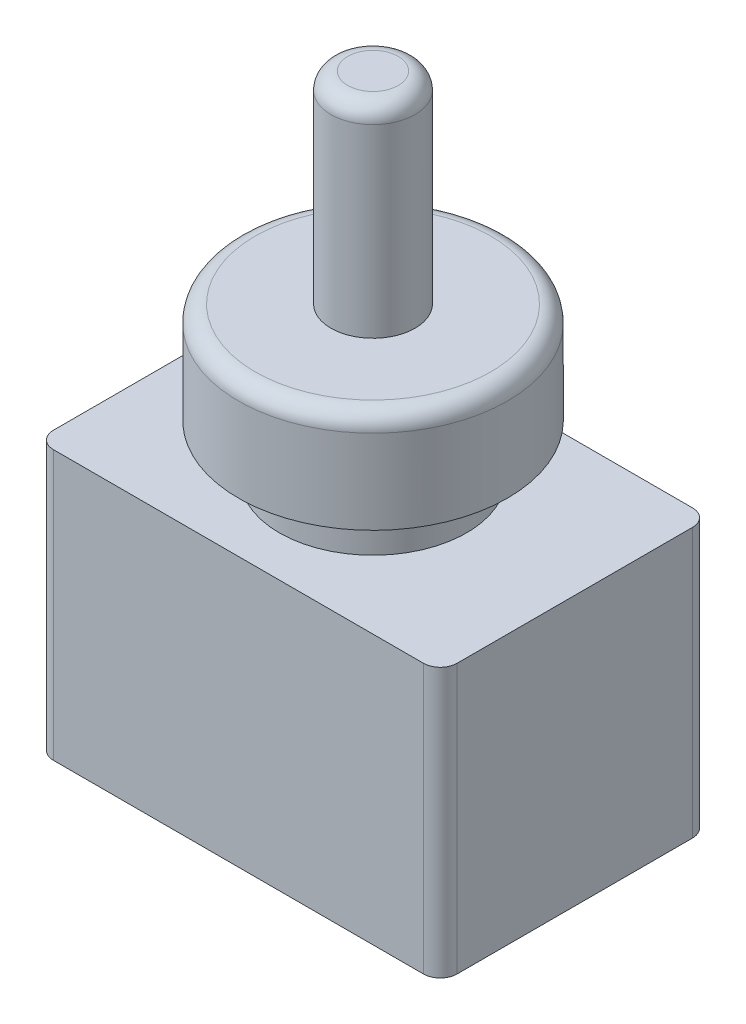
from build123d import *

# Parameters (mm, degrees)
SKETCH1_W           = 24
SKETCH1_H           = 16
BOSS_EXTRUDE1_DEPTH = 16
SKETCH2_R           = 5.571856639
BOSS_EXTRUDE2_DEPTH = 3
FILLET1_R           = 1
FILLET2_R           = 1
FILLET3_R           = 1


with BuildPart() as part:
    # Sketch1 → Boss-Extrude1 (new body)
    with BuildSketch(Plane(origin=(0, 0, 0), x_dir=(1, 0, 0), z_dir=(0, 1, 0))):
        Rectangle(SKETCH1_W, SKETCH1_H)
    extrude(amount=BOSS_EXTRUDE1_DEPTH)

    # Sketch2 → Boss-Extrude2 (add)
    with BuildSketch(Plane(origin=(0, 16, 0), x_dir=(1, 0, 0), z_dir=(0, 1, 0))):
        with Locations(Location((0, 0, 0), (0, 0, 270))):
            Circle(SKETCH2_R)
    extrude(amount=BOSS_EXTRUDE2_DEPTH)

    # Sketch4 → Revolve1 (revolve)
    with BuildSketch(Plane.XY):
        Polygon((0, 19), (8, 19), (8, 25), (2.5, 25), (2.5, 37), (0, 37), align=None)
    revolve(axis=Axis((0, 0, 0), (0, 1, 0)))

    # Fillet1
    fillet1_edges = [part.edges().sort_by_distance(p)[0] for p in [
        (-8, 25, 0),
    ]]
    fillet(fillet1_edges, radius=FILLET1_R)

    # Fillet2
    fillet2_edges = [part.edges().sort_by_distance(p)[0] for p in [
        (-2.5, 37, 0),
    ]]
    fillet(fillet2_edges, radius=FILLET2_R)

    # Fillet3
    fillet3_edges = [part.edges().sort_by_distance(p)[0] for p in [
        (12, 8, 8),
        (-12, 8, 8),
        (-12, 8, -8),
        (12, 8, -8),
    ]]
    fillet(fillet3_edges, radius=FILLET3_R)


solid = part.part
